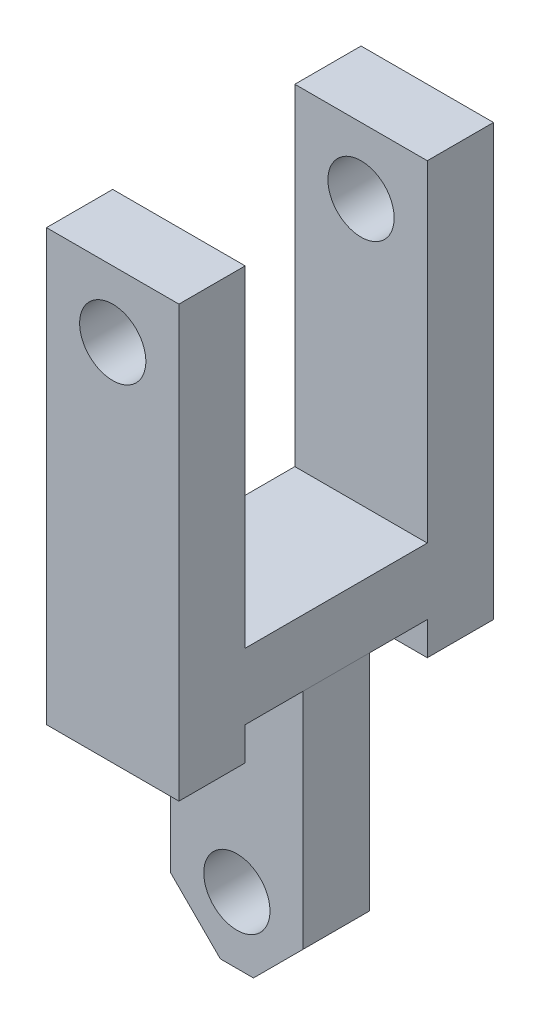
from build123d import *

# Parameters (mm, degrees)
SKETCH1_W                      = 50.8
SKETCH1_H                      = 257.175
SKETCH1_R                      = 12.7
EXTRUDE1_DEPTH                 = 60.325
CUT_EXTRUDE1_DEPTH             = 179.146927159
CUT_EXTRUDE2_REACH             = 146.288
CUT_EXTRUDE2_DIRECTION_2_REACH = 146.288
SKETCH4_W                      = 50.8
SKETCH4_H                      = 120.65
EXTRUDE2_DEPTH                 = 25.4


with BuildPart() as part:
    # Sketch1 → Extrude1 (new, symmetric)
    with BuildSketch(Plane.XY):
        Rectangle(SKETCH1_W, SKETCH1_H)
        with Locations(Location((0, 103.1875, 0), (0, 0, 180))):
            Circle(SKETCH1_R, mode=Mode.SUBTRACT)
        with Locations(Location((0, -103.1875, 0), (0, 0, 180))):
            Circle(SKETCH1_R, mode=Mode.SUBTRACT)
    extrude(amount=EXTRUDE1_DEPTH, both=True)

    # Sketch2 → Cut-Extrude1 (cut, through all)
    with BuildSketch(Plane.XY.offset(60.325)):
        Polygon((-25.4, -109.5375), (-6.35, -128.5875), (-25.4, -128.5875), align=None)
        Polygon((25.4, -109.5375), (25.4, -128.5875), (6.35, -128.5875), align=None)
    extrude(amount=-CUT_EXTRUDE1_DEPTH, mode=Mode.SUBTRACT)

    # Sketch3 → Cut-Extrude2 (cut, up to next)
    with BuildSketch(Plane(origin=(0, 0, 0), x_dir=(0, 0, -1), z_dir=(1, 0, 0)), mode=Mode.PRIVATE) as cut_extrude2_sk1:
        Polygon((-34.925, 128.5875), (34.925, 128.5875), (34.925, -36.5125), (60.325, -36.5125), (60.325, -128.5875), (12.7, -128.5875), (12.7, -23.8125), (-12.7, -23.8125), (-12.7, -128.5875), (-60.325, -128.5875), (-60.325, -36.5125), (-34.925, -36.5125), align=None)
    cut_extrude2_tool1 = extrude(cut_extrude2_sk1.sketch, amount=-CUT_EXTRUDE2_REACH, mode=Mode.PRIVATE) & part.part
    add(cut_extrude2_tool1.solids().sort_by_distance((0, -9.175782, 0))[0], mode=Mode.SUBTRACT)

    # Sketch3 → Cut-Extrude2 direction 2 (cut, up to next)
    with BuildSketch(Plane(origin=(0, 0, 0), x_dir=(0, 0, -1), z_dir=(1, 0, 0)), mode=Mode.PRIVATE) as cut_extrude2_direction_2_sk1:
        Polygon((-34.925, 128.5875), (34.925, 128.5875), (34.925, -36.5125), (60.325, -36.5125), (60.325, -128.5875), (12.7, -128.5875), (12.7, -23.8125), (-12.7, -23.8125), (-12.7, -128.5875), (-60.325, -128.5875), (-60.325, -36.5125), (-34.925, -36.5125), align=None)
    cut_extrude2_direction_2_tool1 = extrude(cut_extrude2_direction_2_sk1.sketch, amount=CUT_EXTRUDE2_DIRECTION_2_REACH, mode=Mode.PRIVATE) & part.part
    add(cut_extrude2_direction_2_tool1.solids().sort_by_distance((0, -9.175782, 0))[0], mode=Mode.SUBTRACT)


with BuildPart() as cut_extrude2_piece_1:
    # of the separate pieces the step leaves, piece 1, a body of its own (cut_extrude2_pieces)
    add(part.part.solids().sort_by_distance((-25.4, 128.5875, -60.325))[0])



with BuildPart() as cut_extrude2_piece_2:
    # of the separate pieces the step leaves, piece 2, a body of its own (cut_extrude2_pieces)
    add(part.part.solids().sort_by_distance((-25.4, 128.5875, 34.925))[0])


with BuildPart() as cut_extrude2_piece_3:
    # of the separate pieces the step leaves, piece 3, a body of its own (cut_extrude2_pieces)
    add(part.part.solids().sort_by_distance((-25.4, -109.5375, 12.7))[0])


with BuildPart() as cut_extrude2_piece_1_1:
    add(cut_extrude2_piece_1.part)

    add(cut_extrude2_piece_2.part)  # Extrude2 merges Cut-Extrude2 piece 2
    # Sketch4 → Extrude2 (add)
    with BuildSketch(Plane.XZ.offset(23.8125)):
        Rectangle(SKETCH4_W, SKETCH4_H)
    extrude(amount=-EXTRUDE2_DEPTH)


solid = Compound([cut_extrude2_piece_3.part, cut_extrude2_piece_1_1.part])
